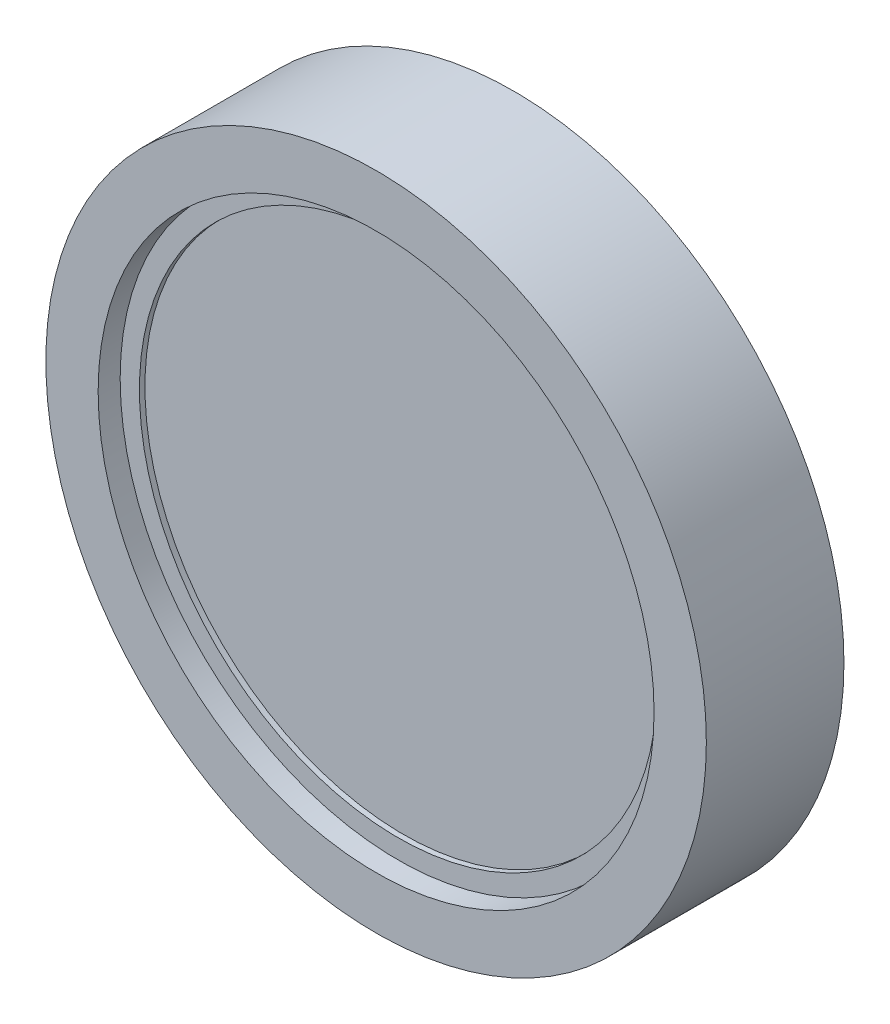
from build123d import *

# Parameters (mm, degrees)
BACKER_MAIN_R              = 15.24
BOSS_EXTRUDE1_DEPTH        = 6.35
SUBSTRATE_BACK_CLEARANCE_R = 11.938
CUT_EXTRUDE1_DEPTH         = 1.27
SUBSTRATE_CSINK_R          = 12.827
CUT_EXTRUDE2_DEPTH         = 1.016
SPRING_HOLE_R              = 4.7625
CUT_EXTRUDE3_DEPTH         = 3.175


with BuildPart() as part:
    # Backer Main → Boss-Extrude1 (new body)
    with BuildSketch(Plane.XY):
        Circle(BACKER_MAIN_R)
    extrude(amount=-BOSS_EXTRUDE1_DEPTH)

    # Substrate Back Clearance → Cut-Extrude1 (cut)
    with BuildSketch(Plane.XY):
        Circle(SUBSTRATE_BACK_CLEARANCE_R)
    extrude(amount=-CUT_EXTRUDE1_DEPTH, mode=Mode.SUBTRACT)

    # Substrate CSink → Cut-Extrude2 (cut)
    with BuildSketch(Plane.XY):
        Circle(SUBSTRATE_CSINK_R)
    extrude(amount=-CUT_EXTRUDE2_DEPTH, mode=Mode.SUBTRACT)

    # Spring Hole → Cut-Extrude3 (cut)
    with BuildSketch(Plane(origin=(0, 0, -6.35), x_dir=(-1, 0, 0), z_dir=(0, 0, -1))):
        Circle(SPRING_HOLE_R)
    extrude(amount=-CUT_EXTRUDE3_DEPTH, mode=Mode.SUBTRACT)


solid = part.part
